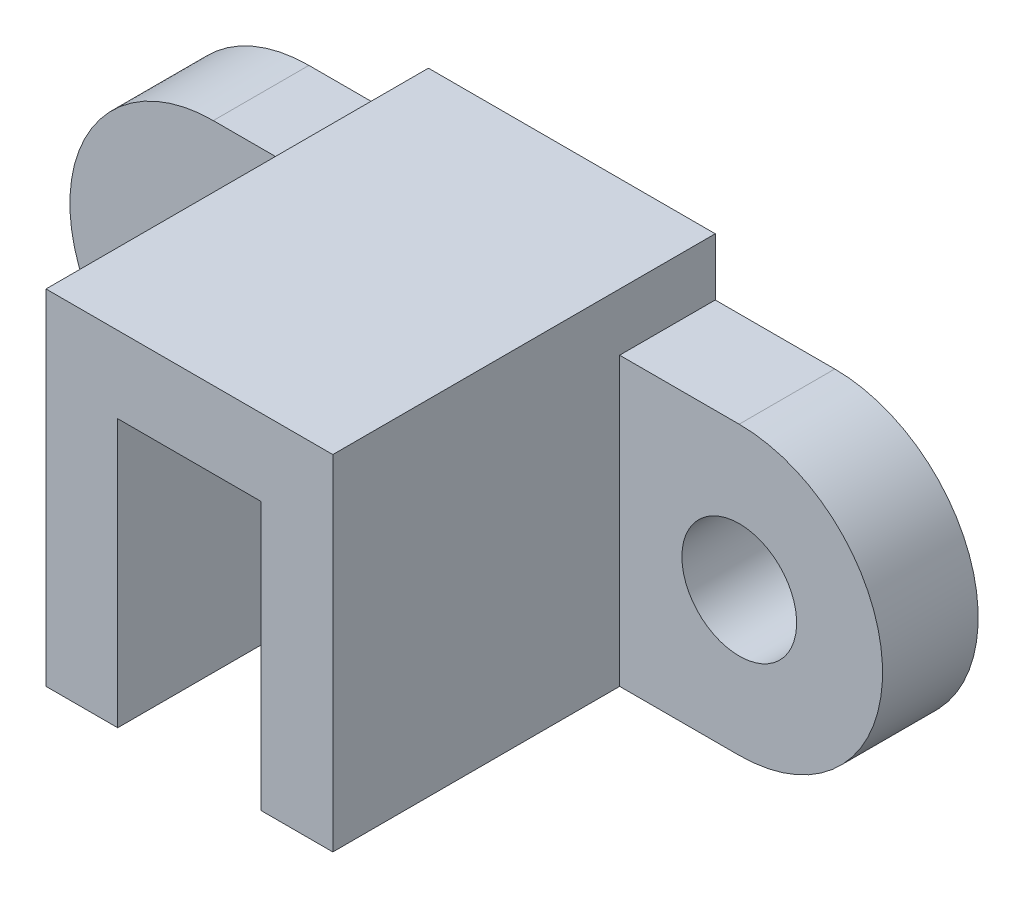
from build123d import *

# Parameters (mm, degrees)
EXTRUDE_1_DEPTH     = 10
SKETCH_3_W          = 30
SKETCH_3_H          = 36
EXTRUDE_2_DEPTH     = 30
SKETCH_4_R          = 6
CUT_EXTRUDE_1_DEPTH = 52
CUT_EXTRUDE_START   = -7.5
CUT_EXTRUDE_2_DEPTH = 15


with BuildPart() as part:
    # 草图1 → 凸台-拉伸1 (new body)
    with BuildSketch(Plane.XY):
        with BuildLine():
            Line((15, -18), (-15, -18))
            Line((-15, -18), (-27.5, -18))
            ThreePointArc((-27.5, -18), (-38.106601718, -13.606601718), (-42.5, -3))
            ThreePointArc((-42.5, -3), (-38.106601718, 7.606601718), (-27.5, 12))
            Line((-27.5, 12), (-15, 12))
            Line((-15, 12), (-15, 18))
            Line((-15, 18), (15, 18))
            Line((15, 18), (15, 12))
            Line((15, 12), (27.5, 12))
            ThreePointArc((27.5, 12), (38.106601718, 7.606601718), (42.5, -3))
            ThreePointArc((42.5, -3), (38.106601718, -13.606601718), (27.5, -18))
            Line((27.5, -18), (15, -18))
        make_face()
    extrude(amount=EXTRUDE_1_DEPTH)

    # 草图3 → 凸台-拉伸2 (add)
    with BuildSketch(Plane.XY.offset(10)):
        Rectangle(SKETCH_3_W, SKETCH_3_H)
    extrude(amount=EXTRUDE_2_DEPTH)

    # 草图4 → 切除-拉伸1 (cut)
    with BuildSketch(Plane.XY):
        with Locations(Location((-27.5, -3, 0), (0, 0, 180))):
            Circle(SKETCH_4_R)
        with Locations(Location((27.511001478, -3, 0), (0, 0, 180))):
            Circle(SKETCH_4_R)
    extrude(amount=CUT_EXTRUDE_1_DEPTH, mode=Mode.SUBTRACT)

    # 草图5 → 切除-拉伸2 (cut)
    with BuildSketch(Plane.ZY.offset(15).offset(CUT_EXTRUDE_START)):
        Polygon((40, 10), (0, -12), (0, -18), (40, -18), align=None)
    extrude(amount=-CUT_EXTRUDE_2_DEPTH, mode=Mode.SUBTRACT)


solid = part.part
